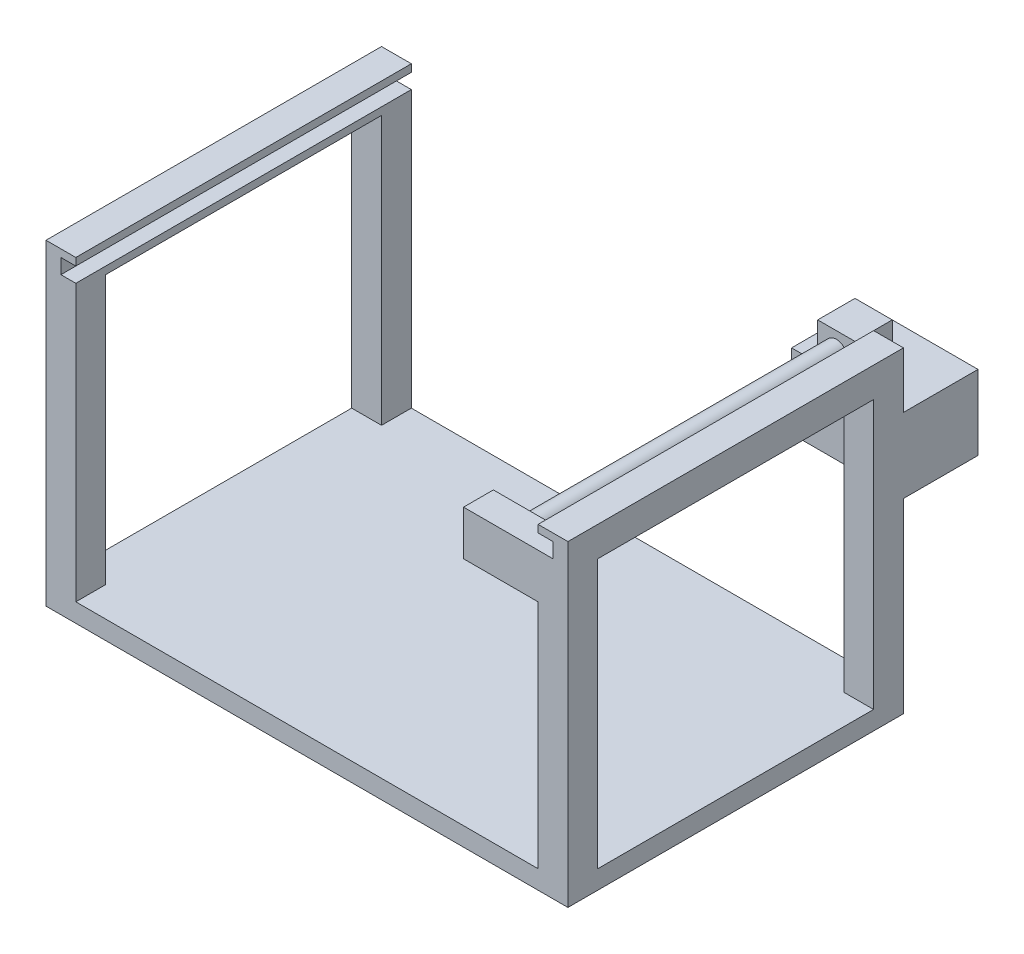
from build123d import *

# Parameters (mm, degrees)
SKETCH_1_W          = 140
SKETCH_1_H          = 5
EXTRUDE_1_DEPTH     = 90
SKETCH_2_W          = 8
SKETCH_2_H          = 8
EXTRUDE_2_DEPTH     = 80
EXTRUDE_3_REACH     = 185.164
SKETCH_3_W          = 8
SKETCH_3_H          = 8
SKETCH_4_W          = 4
SKETCH_4_H          = 4
CUT_EXTRUDE_1_DEPTH = 90
SKETCH_5_W          = 30
SKETCH_5_H          = 20
EXTRUDE_4_DEPTH     = 20
SKETCH_6_W          = 10
SKETCH_6_H          = 10
EXTRUDE_5_DEPTH     = 10
SKETCH_7_R          = 3
EXTRUDE_6_DEPTH     = 82
SKETCH_8_W          = 8
SKETCH_8_H          = 12
EXTRUDE_7_DEPTH     = 20


with BuildPart() as part:
    # 草图1 → 凸台-拉伸1 (new body)
    with BuildSketch(Plane.XY):
        with Locations((70, 2.5)):
            Rectangle(SKETCH_1_W, SKETCH_1_H)
    extrude(amount=-EXTRUDE_1_DEPTH)

    # 草图2 → 凸台-拉伸2 (add)
    with BuildSketch(Plane(origin=(0, 5, 0), x_dir=(1, 0, 0), z_dir=(0, 1, 0))):
        with Locations((4, 4)):
            Rectangle(SKETCH_2_W, SKETCH_2_H)
        with Locations((4, 86)):
            Rectangle(SKETCH_2_W, SKETCH_2_H)
        with Locations((136, 86)):
            Rectangle(SKETCH_2_W, SKETCH_2_H)
        with Locations((136, 4)):
            Rectangle(SKETCH_2_W, SKETCH_2_H)
    extrude(amount=EXTRUDE_2_DEPTH)

    # 草图3 → 凸台-拉伸3 (add, up to next)
    with BuildSketch(Plane.XY.offset(-82), mode=Mode.PRIVATE) as extrude_3_sk1:
        with Locations((4, 81)):
            Rectangle(SKETCH_3_W, SKETCH_3_H)
    extrude_3_tool1 = extrude(extrude_3_sk1.sketch, amount=EXTRUDE_3_REACH, mode=Mode.PRIVATE) - part.part
    # 草图3 → 凸台-拉伸3 (add, up to next)
    with BuildSketch(Plane.XY.offset(-82), mode=Mode.PRIVATE) as extrude_3_sk2:
        with Locations((136, 81)):
            Rectangle(SKETCH_3_W, SKETCH_3_H)
    extrude_3_tool2 = extrude(extrude_3_sk2.sketch, amount=EXTRUDE_3_REACH, mode=Mode.PRIVATE) - part.part
    add(extrude_3_tool1.solids().sort_by_distance((4, 81, -82))[0])
    add(extrude_3_tool2.solids().sort_by_distance((136, 81, -82))[0])

    # 草图4 → 切除-拉伸1 (cut)
    with BuildSketch(Plane.XY):
        with Locations((6, 81)):
            Rectangle(SKETCH_4_W, SKETCH_4_H)
        with Locations((134, 81)):
            Rectangle(SKETCH_4_W, SKETCH_4_H)
    extrude(amount=-CUT_EXTRUDE_1_DEPTH, mode=Mode.SUBTRACT)

    # 草图5 → 凸台-拉伸4 (add)
    with BuildSketch(Plane(origin=(0, 0, -90), x_dir=(-1, 0, 0), z_dir=(0, 0, -1))):
        with Locations((-125, 60)):
            Rectangle(SKETCH_5_W, SKETCH_5_H)
    extrude(amount=EXTRUDE_4_DEPTH)

    # 草图6 → 凸台-拉伸5 (add)
    with BuildSketch(Plane(origin=(0, 70, 0), x_dir=(1, 0, 0), z_dir=(0, 1, 0))):
        with Locations((122, 95)):
            Rectangle(SKETCH_6_W, SKETCH_6_H)
    extrude(amount=EXTRUDE_5_DEPTH)

    # 草图7 → 凸台-拉伸6 (add)
    with BuildSketch(Plane.XY.offset(-90)):
        with Locations((122, 75)):
            Circle(SKETCH_7_R)
    extrude(amount=EXTRUDE_6_DEPTH)

    # 草图8 → 凸台-拉伸7 (add)
    with BuildSketch(Plane.ZY.offset(-132)):
        with Locations((-4, 73)):
            Rectangle(SKETCH_8_W, SKETCH_8_H)
    extrude(amount=EXTRUDE_7_DEPTH)


solid = part.part
